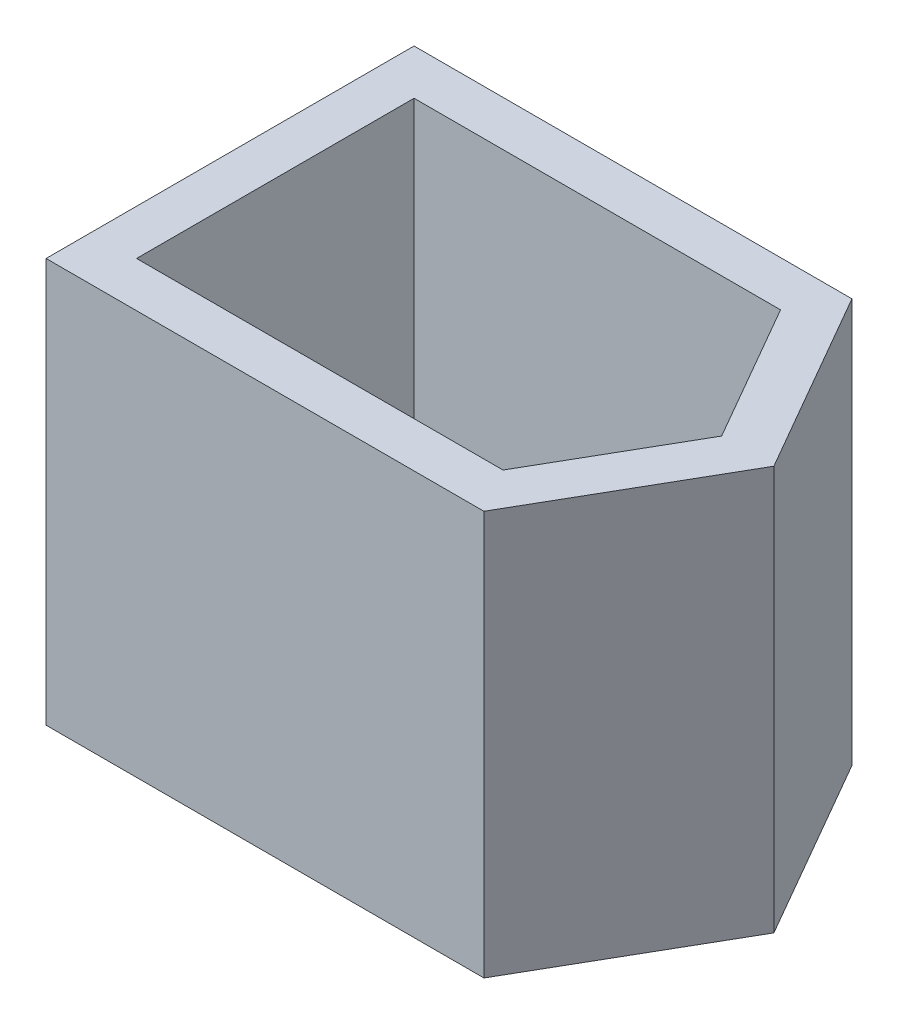
from build123d import *

# Parameters (mm, degrees)
BOSS_EXTRUDE1_DEPTH = 67


with BuildPart() as part:
    # Sketch2 → Boss-Extrude1 (new body)
    with BuildSketch(Plane(origin=(0, 0, 0), x_dir=(1, 0, 0), z_dir=(0, 1, 0))):
        Polygon((62.582215103, 51), (-10, 51), (-10, -10), (62.582215103, -10), (80.138312664, 20.5), align=None)
        Polygon((-2.5, 43.5), (-2.5, -2.5), (58.245553776, -2.5), (71.484578166, 20.5), (58.245553776, 43.5), align=None, mode=Mode.SUBTRACT)
    extrude(amount=BOSS_EXTRUDE1_DEPTH)


solid = part.part
